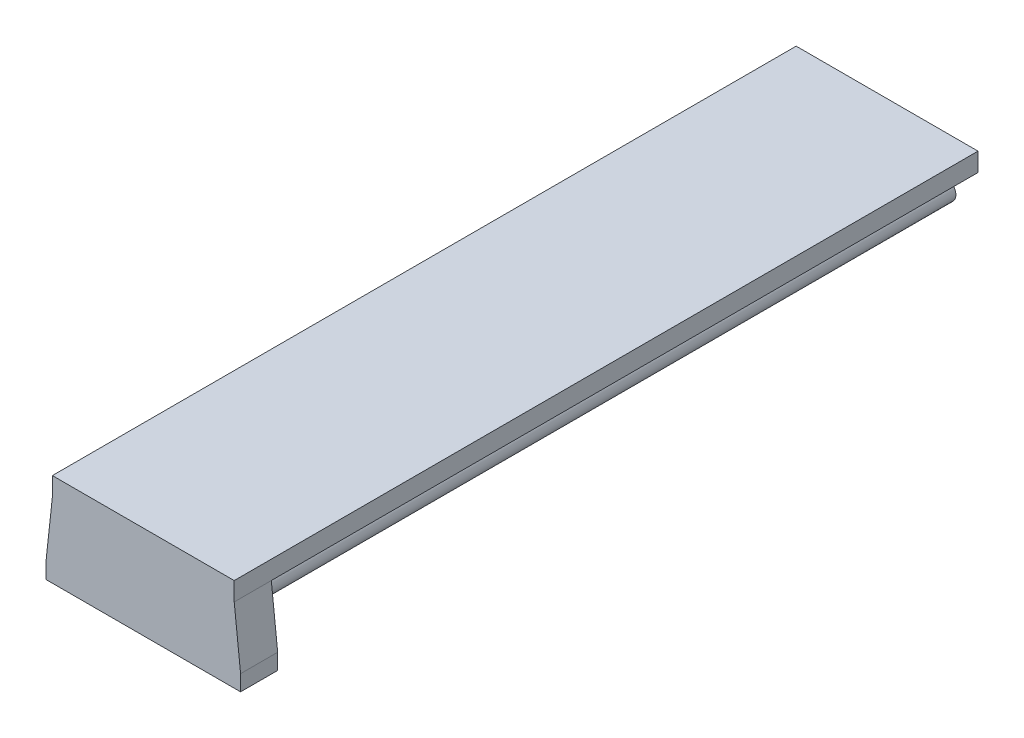
from build123d import *

# Parameters (mm, degrees)
BOSS_EXTRUDE1_DEPTH = 76.2
BOSS_EXTRUDE2_DEPTH = 4


with BuildPart() as part:
    # Sketch1 → Boss-Extrude1 (new body)
    with BuildSketch(Plane.XY):
        with BuildLine():
            Line((-3.2512, 11.760835), (-3.2512, 11.429365))
            ThreePointArc((-3.2512, 11.429365), (-3.52627506, 10.76527506), (-4.190365, 10.4902))
            Line((-4.190365, 10.4902), (-6.348478019, 10.4902))
            ThreePointArc((-6.348478019, 10.4902), (-7.335478831, 9.830707141), (-7.103895736, 8.666460301))
            Line((-7.103895736, 8.666460301), (-3.737334563, 5.299899128))
            ThreePointArc((-3.737334563, 5.299899128), (-3.015479634, 4.817571085), (-2.16399369, 4.6482))
            Line((-2.16399369, 4.6482), (2.16399369, 4.6482))
            ThreePointArc((2.16399369, 4.6482), (3.015479634, 4.817571085), (3.737334563, 5.299899128))
            Line((3.737334563, 5.299899128), (7.103895736, 8.666460301))
            ThreePointArc((7.103895736, 8.666460301), (7.335478831, 9.830707141), (6.348478019, 10.4902))
            Line((6.348478019, 10.4902), (4.190365, 10.4902))
            ThreePointArc((4.190365, 10.4902), (3.52627506, 10.76527506), (3.2512, 11.429365))
            Line((3.2512, 11.429365), (3.2512, 11.760835))
            ThreePointArc((3.2512, 11.760835), (3.52627506, 12.42492494), (4.190365, 12.7))
            Line((4.190365, 12.7), (5.243578019, 12.7))
            Line((5.243578019, 12.7), (6.348478019, 12.7))
            Line((6.348478019, 12.7), (9.803703152, 12.7))
            Line((9.803703152, 12.7), (9.803703152, 14.7))
            Line((9.803703152, 14.7), (-9.803703152, 14.7))
            Line((-9.803703152, 14.7), (-9.803703152, 12.7))
            Line((-9.803703152, 12.7), (-5.243578019, 12.7))
            Line((-5.243578019, 12.7), (-4.190365, 12.7))
            ThreePointArc((-4.190365, 12.7), (-3.52627506, 12.42492494), (-3.2512, 11.760835))
        make_face()
    extrude(amount=-BOSS_EXTRUDE1_DEPTH)

    # Sketch1<3> → Boss-Extrude2 (add)
    with BuildSketch(Plane.XY):
        Polygon((-10.4902, 4.6482), (10.4902, 4.6482), (10.4902, 6.348478019), (9.803703152, 12.7), (9.803703152, 14.7), (-9.803703152, 14.7), (-9.803703152, 12.7), (-10.4902, 6.348478019), align=None)
    extrude(amount=BOSS_EXTRUDE2_DEPTH)


solid = part.part
